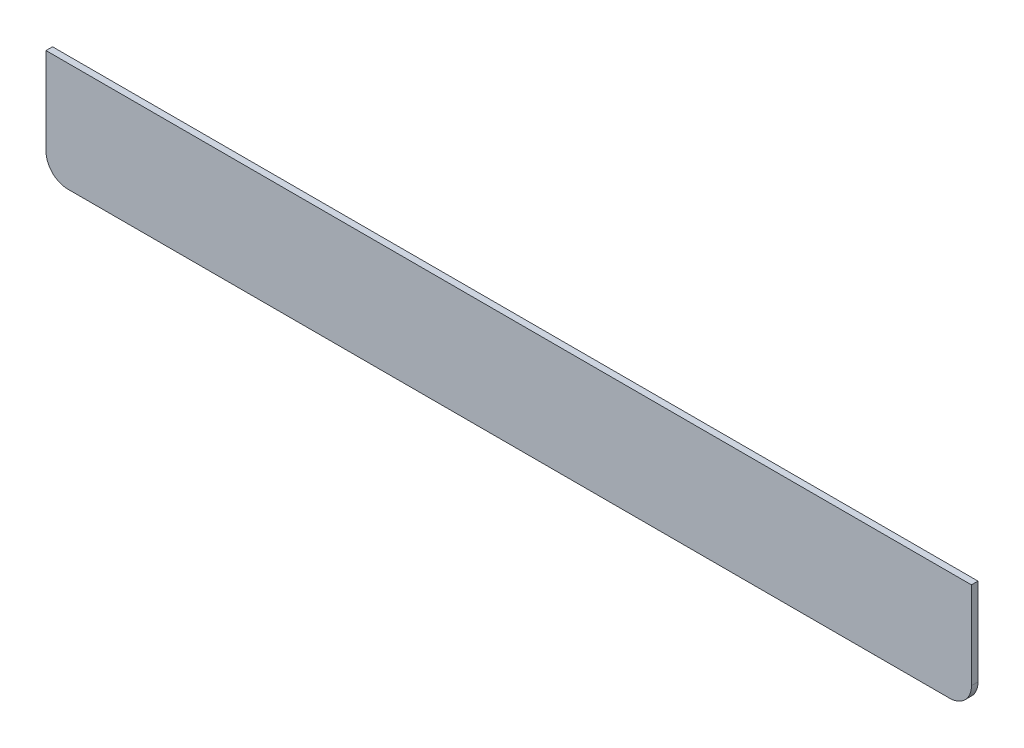
from build123d import *

# Parameters (mm, degrees)
SKETCH_1_W      = 424
SKETCH_1_H      = 50
EXTRUDE_1_DEPTH = 3
FILLET_1_R      = 10


with BuildPart() as part:
    # Эскиз1 → Бобышка-Вытянуть1 (new body)
    with BuildSketch(Plane.XY):
        Rectangle(SKETCH_1_W, SKETCH_1_H)
    extrude(amount=EXTRUDE_1_DEPTH)

    # Скругление1
    fillet_1_edges = [part.edges().sort_by_distance(p)[0] for p in [
        (212, -25, 1.5),
        (-212, -25, 1.5),
    ]]
    fillet(fillet_1_edges, radius=FILLET_1_R)


solid = part.part
